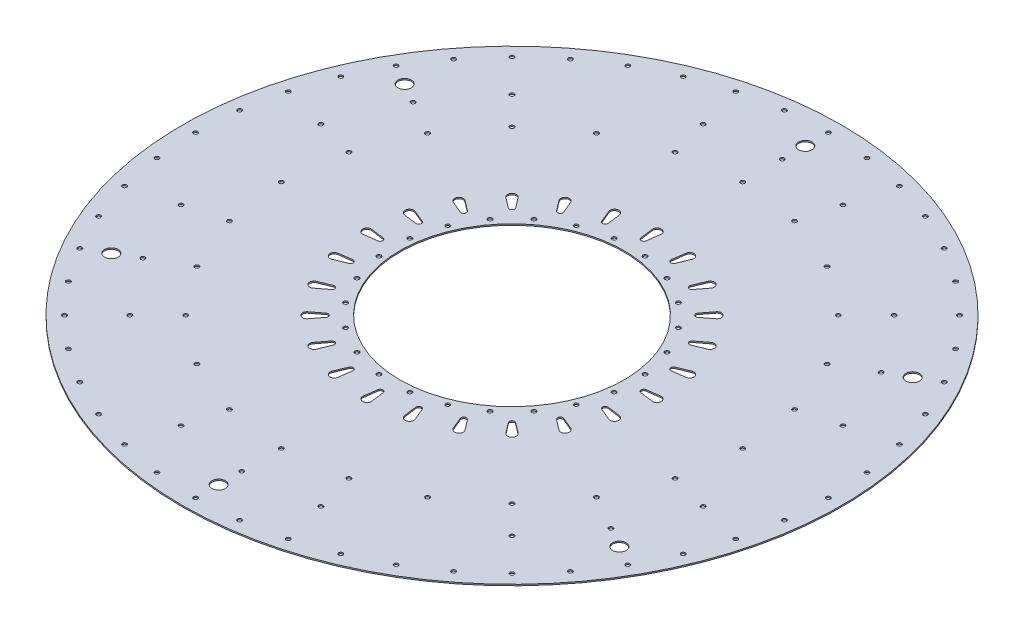
from build123d import *

# Parameters (mm, degrees)
SKETCH2_R           = 250
SKETCH2_R_2         = 1.6
SKETCH2_R_3         = 85
SKETCH2_R_4         = 5.1
BOSS_EXTRUDE1_DEPTH = 0.5


with BuildPart() as part:
    # Sketch2 → Boss-Extrude1 (new, symmetric)
    with BuildSketch(Plane(origin=(0, 0, 0), x_dir=(1, 0, 0), z_dir=(0, 1, 0))):
        with Locations(Location((0, 0, 0), (0, 0, 270))):
            Circle(SKETCH2_R)
        with Locations(Location((0, 240, 0), (0, 0, 270))):
            Circle(SKETCH2_R_2, mode=Mode.SUBTRACT)
        with Locations(Location((0, 0, 0), (0, 0, 270))):
            Circle(SKETCH2_R_3, mode=Mode.SUBTRACT)
        with Locations(Location((31.326286133, 237.94676673, 0), (0, 0, 270))):
            Circle(SKETCH2_R_2, mode=Mode.SUBTRACT)
        with Locations(Location((62.116570825, 231.822198309, 0), (0, 0, 270))):
            Circle(SKETCH2_R_2, mode=Mode.SUBTRACT)
        with Locations(Location((91.844023768, 221.731087803, 0), (0, 0, 270))):
            Circle(SKETCH2_R_2, mode=Mode.SUBTRACT)
        with Locations(Location((120, 207.846096908, 0), (0, 0, 270))):
            Circle(SKETCH2_R_2, mode=Mode.SUBTRACT)
        with Locations(Location((146.102742962, 190.40480167, 0), (0, 0, 270))):
            Circle(SKETCH2_R_2, mode=Mode.SUBTRACT)
        with Locations(Location((207.846096908, -120, 0), (0, 0, 270))):
            Circle(SKETCH2_R_2, mode=Mode.SUBTRACT)
        with Locations(Location((169.705627485, -169.705627485, 0), (0, 0, 270))):
            Circle(SKETCH2_R_2, mode=Mode.SUBTRACT)
        with Locations(Location((120, -207.846096908, 0), (0, 0, 270))):
            Circle(SKETCH2_R_2, mode=Mode.SUBTRACT)
        with Locations(Location((62.116570825, -231.822198309, 0), (0, 0, 270))):
            Circle(SKETCH2_R_2, mode=Mode.SUBTRACT)
        with Locations(Location((0, -240, 0), (0, 0, 270))):
            Circle(SKETCH2_R_2, mode=Mode.SUBTRACT)
        with Locations(Location((-62.116570825, -231.822198309, 0), (0, 0, 270))):
            Circle(SKETCH2_R_2, mode=Mode.SUBTRACT)
        with Locations(Location((-120, -207.846096908, 0), (0, 0, 270))):
            Circle(SKETCH2_R_2, mode=Mode.SUBTRACT)
        with Locations(Location((-169.705627485, -169.705627485, 0), (0, 0, 270))):
            Circle(SKETCH2_R_2, mode=Mode.SUBTRACT)
        with Locations(Location((-207.846096908, -120, 0), (0, 0, 270))):
            Circle(SKETCH2_R_2, mode=Mode.SUBTRACT)
        with Locations(Location((-231.822198309, -62.116570825, 0), (0, 0, 270))):
            Circle(SKETCH2_R_2, mode=Mode.SUBTRACT)
        with Locations(Location((-240, 0, 0), (0, 0, 270))):
            Circle(SKETCH2_R_2, mode=Mode.SUBTRACT)
        with Locations(Location((-231.822198309, 62.116570825, 0), (0, 0, 270))):
            Circle(SKETCH2_R_2, mode=Mode.SUBTRACT)
        with Locations(Location((-207.846096908, 120, 0), (0, 0, 270))):
            Circle(SKETCH2_R_2, mode=Mode.SUBTRACT)
        with Locations(Location((-169.705627485, 169.705627485, 0), (0, 0, 270))):
            Circle(SKETCH2_R_2, mode=Mode.SUBTRACT)
        with Locations(Location((-120, 207.846096908, 0), (0, 0, 270))):
            Circle(SKETCH2_R_2, mode=Mode.SUBTRACT)
        with Locations(Location((-62.116570825, 231.822198309, 0), (0, 0, 270))):
            Circle(SKETCH2_R_2, mode=Mode.SUBTRACT)
        with Locations(Location((169.705627485, 169.705627485, 0), (0, 0, 270))):
            Circle(SKETCH2_R_2, mode=Mode.SUBTRACT)
        with Locations(Location((190.40480167, 146.102742962, 0), (0, 0, 270))):
            Circle(SKETCH2_R_2, mode=Mode.SUBTRACT)
        with Locations(Location((207.846096908, 120, 0), (0, 0, 270))):
            Circle(SKETCH2_R_2, mode=Mode.SUBTRACT)
        with Locations(Location((221.731087803, 91.844023768, 0), (0, 0, 270))):
            Circle(SKETCH2_R_2, mode=Mode.SUBTRACT)
        with Locations(Location((231.822198309, 62.116570825, 0), (0, 0, 270))):
            Circle(SKETCH2_R_2, mode=Mode.SUBTRACT)
        with Locations(Location((237.94676673, 31.326286133, 0), (0, 0, 270))):
            Circle(SKETCH2_R_2, mode=Mode.SUBTRACT)
        with Locations(Location((240, 0, 0), (0, 0, 270))):
            Circle(SKETCH2_R_2, mode=Mode.SUBTRACT)
        with Locations(Location((237.94676673, -31.326286133, 0), (0, 0, 270))):
            Circle(SKETCH2_R_2, mode=Mode.SUBTRACT)
        with Locations(Location((231.822198309, -62.116570825, 0), (0, 0, 270))):
            Circle(SKETCH2_R_2, mode=Mode.SUBTRACT)
        with Locations(Location((221.731087803, -91.844023768, 0), (0, 0, 270))):
            Circle(SKETCH2_R_2, mode=Mode.SUBTRACT)
        with Locations(Location((190.40480167, -146.102742962, 0), (0, 0, 270))):
            Circle(SKETCH2_R_2, mode=Mode.SUBTRACT)
        with Locations(Location((146.102742962, -190.40480167, 0), (0, 0, 270))):
            Circle(SKETCH2_R_2, mode=Mode.SUBTRACT)
        with Locations(Location((91.844023768, -221.731087803, 0), (0, 0, 270))):
            Circle(SKETCH2_R_2, mode=Mode.SUBTRACT)
        with Locations(Location((31.326286133, -237.94676673, 0), (0, 0, 270))):
            Circle(SKETCH2_R_2, mode=Mode.SUBTRACT)
        with Locations(Location((-31.326286133, -237.94676673, 0), (0, 0, 270))):
            Circle(SKETCH2_R_2, mode=Mode.SUBTRACT)
        with Locations(Location((-91.844023768, -221.731087803, 0), (0, 0, 270))):
            Circle(SKETCH2_R_2, mode=Mode.SUBTRACT)
        with Locations(Location((-146.102742962, -190.40480167, 0), (0, 0, 270))):
            Circle(SKETCH2_R_2, mode=Mode.SUBTRACT)
        with Locations(Location((-190.40480167, -146.102742962, 0), (0, 0, 270))):
            Circle(SKETCH2_R_2, mode=Mode.SUBTRACT)
        with Locations(Location((-221.731087803, -91.844023768, 0), (0, 0, 270))):
            Circle(SKETCH2_R_2, mode=Mode.SUBTRACT)
        with Locations(Location((-237.94676673, -31.326286133, 0), (0, 0, 270))):
            Circle(SKETCH2_R_2, mode=Mode.SUBTRACT)
        with Locations(Location((-237.94676673, 31.326286133, 0), (0, 0, 270))):
            Circle(SKETCH2_R_2, mode=Mode.SUBTRACT)
        with Locations(Location((-221.731087803, 91.844023768, 0), (0, 0, 270))):
            Circle(SKETCH2_R_2, mode=Mode.SUBTRACT)
        with Locations(Location((-190.40480167, 146.102742962, 0), (0, 0, 270))):
            Circle(SKETCH2_R_2, mode=Mode.SUBTRACT)
        with Locations(Location((-146.102742962, 190.40480167, 0), (0, 0, 270))):
            Circle(SKETCH2_R_2, mode=Mode.SUBTRACT)
        with Locations(Location((-91.844023768, 221.731087803, 0), (0, 0, 270))):
            Circle(SKETCH2_R_2, mode=Mode.SUBTRACT)
        with Locations(Location((-31.326286133, 237.94676673, 0), (0, 0, 270))):
            Circle(SKETCH2_R_2, mode=Mode.SUBTRACT)
        with Locations(Location((0, 222.5, 0), (0, 0, 270))):
            Circle(SKETCH2_R_4, mode=Mode.SUBTRACT)
        with Locations(Location((192.690652342, 111.25, 0), (0, 0, 270))):
            Circle(SKETCH2_R_4, mode=Mode.SUBTRACT)
        with Locations(Location((192.690652342, -111.25, 0), (0, 0, 270))):
            Circle(SKETCH2_R_4, mode=Mode.SUBTRACT)
        with Locations(Location((0, -222.5, 0), (0, 0, 270))):
            Circle(SKETCH2_R_4, mode=Mode.SUBTRACT)
        with Locations(Location((-192.690652342, -111.25, 0), (0, 0, 270))):
            Circle(SKETCH2_R_4, mode=Mode.SUBTRACT)
        with Locations(Location((-192.690652342, 111.25, 0), (0, 0, 270))):
            Circle(SKETCH2_R_4, mode=Mode.SUBTRACT)
        with Locations(Location((0, 175, 0), (0, 0, 270))):
            Circle(SKETCH2_R_2, mode=Mode.SUBTRACT)
        with Locations(Location((45.293332893, 169.037019601, 0), (0, 0, 270))):
            Circle(SKETCH2_R_2, mode=Mode.SUBTRACT)
        with Locations(Location((87.5, 151.554445662, 0), (0, 0, 270))):
            Circle(SKETCH2_R_2, mode=Mode.SUBTRACT)
        with Locations(Location((123.743686708, 123.743686708, 0), (0, 0, 270))):
            Circle(SKETCH2_R_2, mode=Mode.SUBTRACT)
        with Locations(Location((151.554445662, 87.5, 0), (0, 0, 270))):
            Circle(SKETCH2_R_2, mode=Mode.SUBTRACT)
        with Locations(Location((169.037019601, 45.293332893, 0), (0, 0, 270))):
            Circle(SKETCH2_R_2, mode=Mode.SUBTRACT)
        with Locations(Location((175, 0, 0), (0, 0, 270))):
            Circle(SKETCH2_R_2, mode=Mode.SUBTRACT)
        with Locations(Location((169.037019601, -45.293332893, 0), (0, 0, 270))):
            Circle(SKETCH2_R_2, mode=Mode.SUBTRACT)
        with Locations(Location((151.554445662, -87.5, 0), (0, 0, 270))):
            Circle(SKETCH2_R_2, mode=Mode.SUBTRACT)
        with Locations(Location((123.743686708, -123.743686708, 0), (0, 0, 270))):
            Circle(SKETCH2_R_2, mode=Mode.SUBTRACT)
        with Locations(Location((87.5, -151.554445662, 0), (0, 0, 270))):
            Circle(SKETCH2_R_2, mode=Mode.SUBTRACT)
        with Locations(Location((45.293332893, -169.037019601, 0), (0, 0, 270))):
            Circle(SKETCH2_R_2, mode=Mode.SUBTRACT)
        with Locations(Location((0, -175, 0), (0, 0, 270))):
            Circle(SKETCH2_R_2, mode=Mode.SUBTRACT)
        with Locations(Location((-45.293332893, -169.037019601, 0), (0, 0, 270))):
            Circle(SKETCH2_R_2, mode=Mode.SUBTRACT)
        with Locations(Location((-87.5, -151.554445662, 0), (0, 0, 270))):
            Circle(SKETCH2_R_2, mode=Mode.SUBTRACT)
        with Locations(Location((-123.743686708, -123.743686708, 0), (0, 0, 270))):
            Circle(SKETCH2_R_2, mode=Mode.SUBTRACT)
        with Locations(Location((-151.554445662, -87.5, 0), (0, 0, 270))):
            Circle(SKETCH2_R_2, mode=Mode.SUBTRACT)
        with Locations(Location((-169.037019601, -45.293332893, 0), (0, 0, 270))):
            Circle(SKETCH2_R_2, mode=Mode.SUBTRACT)
        with Locations(Location((-175, 0, 0), (0, 0, 270))):
            Circle(SKETCH2_R_2, mode=Mode.SUBTRACT)
        with Locations(Location((-169.037019601, 45.293332893, 0), (0, 0, 270))):
            Circle(SKETCH2_R_2, mode=Mode.SUBTRACT)
        with Locations(Location((-151.554445662, 87.5, 0), (0, 0, 270))):
            Circle(SKETCH2_R_2, mode=Mode.SUBTRACT)
        with Locations(Location((-123.743686708, 123.743686708, 0), (0, 0, 270))):
            Circle(SKETCH2_R_2, mode=Mode.SUBTRACT)
        with Locations(Location((-87.5, 151.554445662, 0), (0, 0, 270))):
            Circle(SKETCH2_R_2, mode=Mode.SUBTRACT)
        with Locations(Location((-45.293332893, 169.037019601, 0), (0, 0, 270))):
            Circle(SKETCH2_R_2, mode=Mode.SUBTRACT)
        with Locations(Location((-198.014794389, 53.057904246, 0), (0, 0, 270))):
            Circle(SKETCH2_R_2, mode=Mode.SUBTRACT)
        with Locations(Location((-177.535207776, 102.5, 0), (0, 0, 270))):
            Circle(SKETCH2_R_2, mode=Mode.SUBTRACT)
        with Locations(Location((-144.956890143, 144.956890143, 0), (0, 0, 270))):
            Circle(SKETCH2_R_2, mode=Mode.SUBTRACT)
        with Locations(Location((-53.057904246, 198.014794389, 0), (0, 0, 270))):
            Circle(SKETCH2_R_2, mode=Mode.SUBTRACT)
        with Locations(Location((0, 205, 0), (0, 0, 270))):
            Circle(SKETCH2_R_2, mode=Mode.SUBTRACT)
        with Locations(Location((53.057904246, 198.014794389, 0), (0, 0, 270))):
            Circle(SKETCH2_R_2, mode=Mode.SUBTRACT)
        with Locations(Location((144.956890143, 144.956890143, 0), (0, 0, 270))):
            Circle(SKETCH2_R_2, mode=Mode.SUBTRACT)
        with Locations(Location((177.535207776, 102.5, 0), (0, 0, 270))):
            Circle(SKETCH2_R_2, mode=Mode.SUBTRACT)
        with Locations(Location((198.014794389, 53.057904246, 0), (0, 0, 270))):
            Circle(SKETCH2_R_2, mode=Mode.SUBTRACT)
        with Locations(Location((198.014794389, -53.057904246, 0), (0, 0, 270))):
            Circle(SKETCH2_R_2, mode=Mode.SUBTRACT)
        with Locations(Location((177.535207776, -102.5, 0), (0, 0, 270))):
            Circle(SKETCH2_R_2, mode=Mode.SUBTRACT)
        with Locations(Location((144.956890143, -144.956890143, 0), (0, 0, 270))):
            Circle(SKETCH2_R_2, mode=Mode.SUBTRACT)
        with Locations(Location((53.057904246, -198.014794389, 0), (0, 0, 270))):
            Circle(SKETCH2_R_2, mode=Mode.SUBTRACT)
        with Locations(Location((0, -205, 0), (0, 0, 270))):
            Circle(SKETCH2_R_2, mode=Mode.SUBTRACT)
        with Locations(Location((-53.057904246, -198.014794389, 0), (0, 0, 270))):
            Circle(SKETCH2_R_2, mode=Mode.SUBTRACT)
        with Locations(Location((-144.956890143, -144.956890143, 0), (0, 0, 270))):
            Circle(SKETCH2_R_2, mode=Mode.SUBTRACT)
        with Locations(Location((-177.535207776, -102.5, 0), (0, 0, 270))):
            Circle(SKETCH2_R_2, mode=Mode.SUBTRACT)
        with Locations(Location((-198.014794389, -53.057904246, 0), (0, 0, 270))):
            Circle(SKETCH2_R_2, mode=Mode.SUBTRACT)
        with Locations(Location((-11.7473573, 89.230037524, 0), (0, 0, 270))):
            Circle(SKETCH2_R_2, mode=Mode.SUBTRACT)
        with Locations(Location((11.7473573, 89.230037524, 0), (0, 0, 270))):
            Circle(SKETCH2_R_2, mode=Mode.SUBTRACT)
        with Locations(Location((34.441508913, 83.149157926, 0), (0, 0, 270))):
            Circle(SKETCH2_R_2, mode=Mode.SUBTRACT)
        with Locations(Location((54.788528611, 71.401800626, 0), (0, 0, 270))):
            Circle(SKETCH2_R_2, mode=Mode.SUBTRACT)
        with Locations(Location((71.401800626, 54.788528611, 0), (0, 0, 270))):
            Circle(SKETCH2_R_2, mode=Mode.SUBTRACT)
        with Locations(Location((83.149157926, 34.441508913, 0), (0, 0, 270))):
            Circle(SKETCH2_R_2, mode=Mode.SUBTRACT)
        with Locations(Location((89.230037524, 11.7473573, 0), (0, 0, 270))):
            Circle(SKETCH2_R_2, mode=Mode.SUBTRACT)
        with Locations(Location((89.230037524, -11.7473573, 0), (0, 0, 270))):
            Circle(SKETCH2_R_2, mode=Mode.SUBTRACT)
        with Locations(Location((83.149157926, -34.441508913, 0), (0, 0, 270))):
            Circle(SKETCH2_R_2, mode=Mode.SUBTRACT)
        with Locations(Location((71.401800626, -54.788528611, 0), (0, 0, 270))):
            Circle(SKETCH2_R_2, mode=Mode.SUBTRACT)
        with Locations(Location((54.788528611, -71.401800626, 0), (0, 0, 270))):
            Circle(SKETCH2_R_2, mode=Mode.SUBTRACT)
        with Locations(Location((34.441508913, -83.149157926, 0), (0, 0, 270))):
            Circle(SKETCH2_R_2, mode=Mode.SUBTRACT)
        with Locations(Location((11.7473573, -89.230037524, 0), (0, 0, 270))):
            Circle(SKETCH2_R_2, mode=Mode.SUBTRACT)
        with Locations(Location((-11.7473573, -89.230037524, 0), (0, 0, 270))):
            Circle(SKETCH2_R_2, mode=Mode.SUBTRACT)
        with Locations(Location((-34.441508913, -83.149157926, 0), (0, 0, 270))):
            Circle(SKETCH2_R_2, mode=Mode.SUBTRACT)
        with Locations(Location((-54.788528611, -71.401800626, 0), (0, 0, 270))):
            Circle(SKETCH2_R_2, mode=Mode.SUBTRACT)
        with Locations(Location((-71.401800626, -54.788528611, 0), (0, 0, 270))):
            Circle(SKETCH2_R_2, mode=Mode.SUBTRACT)
        with Locations(Location((-83.149157926, -34.441508913, 0), (0, 0, 270))):
            Circle(SKETCH2_R_2, mode=Mode.SUBTRACT)
        with Locations(Location((-89.230037524, -11.7473573, 0), (0, 0, 270))):
            Circle(SKETCH2_R_2, mode=Mode.SUBTRACT)
        with Locations(Location((-89.230037524, 11.7473573, 0), (0, 0, 270))):
            Circle(SKETCH2_R_2, mode=Mode.SUBTRACT)
        with Locations(Location((-83.149157926, 34.441508913, 0), (0, 0, 270))):
            Circle(SKETCH2_R_2, mode=Mode.SUBTRACT)
        with Locations(Location((-71.401800626, 54.788528611, 0), (0, 0, 270))):
            Circle(SKETCH2_R_2, mode=Mode.SUBTRACT)
        with Locations(Location((-54.788528611, 71.401800626, 0), (0, 0, 270))):
            Circle(SKETCH2_R_2, mode=Mode.SUBTRACT)
        with Locations(Location((-34.441508913, 83.149157926, 0), (0, 0, 270))):
            Circle(SKETCH2_R_2, mode=Mode.SUBTRACT)
        with BuildLine():
            Line((3.276984948, 109.568576747), (1.982889723, 99.738947616))
            ThreePointArc((1.982889723, 99.738947616), (0, 98), (-1.982889723, 99.738947616))
            Line((-1.982889723, 99.738947616), (-3.276984948, 109.568576747))
            ThreePointArc((-3.276984948, 109.568576747), (0, 113.305261922), (3.276984948, 109.568576747))
        make_face(mode=Mode.SUBTRACT)
        with BuildLine():
            Line((31.523758801, 104.986971915), (27.729663575, 95.827215764))
            ThreePointArc((27.729663575, 95.827215764), (25.36426642, 94.660730976), (23.899014788, 96.853635013))
            Line((23.899014788, 96.853635013), (25.193110013, 106.683264145))
            ThreePointArc((25.193110013, 106.683264145), (29.325559696, 109.444478745), (31.523758801, 104.986971915))
        make_face(mode=Mode.SUBTRACT)
        with BuildLine():
            Line((57.622240587, 93.250678445), (51.586706681, 85.38501752))
            ThreePointArc((51.586706681, 85.38501752), (49, 84.870489571), (48.152240935, 87.367907243))
            Line((48.152240935, 87.367907243), (51.94633616, 96.527663394))
            ThreePointArc((51.94633616, 96.527663394), (56.652630961, 98.125235207), (57.622240587, 93.250678445))
        make_face(mode=Mode.SUBTRACT)
        with BuildLine():
            Line((79.793861902, 75.159505344), (71.928200977, 69.123971438))
            ThreePointArc((71.928200977, 69.123971438), (69.296464556, 69.296464556), (69.123971438, 71.928200977))
            Line((69.123971438, 71.928200977), (75.159505344, 79.793861902))
            ThreePointArc((75.159505344, 79.793861902), (80.118919049, 80.118919049), (79.793861902, 75.159505344))
        make_face(mode=Mode.SUBTRACT)
        with BuildLine():
            Line((96.527663394, 51.94633616), (87.367907243, 48.152240935))
            ThreePointArc((87.367907243, 48.152240935), (84.870489571, 49), (85.38501752, 51.586706681))
            Line((85.38501752, 51.586706681), (93.250678445, 57.622240587))
            ThreePointArc((93.250678445, 57.622240587), (98.125235207, 56.652630961), (96.527663394, 51.94633616))
        make_face(mode=Mode.SUBTRACT)
        with BuildLine():
            Line((106.683264145, 25.193110013), (96.853635013, 23.899014788))
            ThreePointArc((96.853635013, 23.899014788), (94.660730976, 25.36426642), (95.827215764, 27.729663575))
            Line((95.827215764, 27.729663575), (104.986971915, 31.523758801))
            ThreePointArc((104.986971915, 31.523758801), (109.444478745, 29.325559696), (106.683264145, 25.193110013))
        make_face(mode=Mode.SUBTRACT)
        with BuildLine():
            Line((109.568576747, -3.276984948), (99.738947616, -1.982889723))
            ThreePointArc((99.738947616, -1.982889723), (98, 0), (99.738947616, 1.982889723))
            Line((99.738947616, 1.982889723), (109.568576747, 3.276984948))
            ThreePointArc((109.568576747, 3.276984948), (113.305261922, 0), (109.568576747, -3.276984948))
        make_face(mode=Mode.SUBTRACT)
        with BuildLine():
            Line((104.986971915, -31.523758801), (95.827215764, -27.729663575))
            ThreePointArc((95.827215764, -27.729663575), (94.660730976, -25.36426642), (96.853635013, -23.899014788))
            Line((96.853635013, -23.899014788), (106.683264145, -25.193110013))
            ThreePointArc((106.683264145, -25.193110013), (109.444478745, -29.325559696), (104.986971915, -31.523758801))
        make_face(mode=Mode.SUBTRACT)
        with BuildLine():
            Line((93.250678445, -57.622240587), (85.38501752, -51.586706681))
            ThreePointArc((85.38501752, -51.586706681), (84.870489571, -49), (87.367907243, -48.152240935))
            Line((87.367907243, -48.152240935), (96.527663394, -51.94633616))
            ThreePointArc((96.527663394, -51.94633616), (98.125235207, -56.652630961), (93.250678445, -57.622240587))
        make_face(mode=Mode.SUBTRACT)
        with BuildLine():
            Line((75.159505344, -79.793861902), (69.123971438, -71.928200977))
            ThreePointArc((69.123971438, -71.928200977), (69.296464556, -69.296464556), (71.928200977, -69.123971438))
            Line((71.928200977, -69.123971438), (79.793861902, -75.159505344))
            ThreePointArc((79.793861902, -75.159505344), (80.118919049, -80.118919049), (75.159505344, -79.793861902))
        make_face(mode=Mode.SUBTRACT)
        with BuildLine():
            Line((51.94633616, -96.527663394), (48.152240935, -87.367907243))
            ThreePointArc((48.152240935, -87.367907243), (49, -84.870489571), (51.586706681, -85.38501752))
            Line((51.586706681, -85.38501752), (57.622240587, -93.250678445))
            ThreePointArc((57.622240587, -93.250678445), (56.652630961, -98.125235207), (51.94633616, -96.527663394))
        make_face(mode=Mode.SUBTRACT)
        with BuildLine():
            Line((25.193110013, -106.683264145), (23.899014788, -96.853635013))
            ThreePointArc((23.899014788, -96.853635013), (25.36426642, -94.660730976), (27.729663575, -95.827215764))
            Line((27.729663575, -95.827215764), (31.523758801, -104.986971915))
            ThreePointArc((31.523758801, -104.986971915), (29.325559696, -109.444478745), (25.193110013, -106.683264145))
        make_face(mode=Mode.SUBTRACT)
        with BuildLine():
            Line((-3.276984948, -109.568576747), (-1.982889723, -99.738947616))
            ThreePointArc((-1.982889723, -99.738947616), (0, -98), (1.982889723, -99.738947616))
            Line((1.982889723, -99.738947616), (3.276984948, -109.568576747))
            ThreePointArc((3.276984948, -109.568576747), (0, -113.305261922), (-3.276984948, -109.568576747))
        make_face(mode=Mode.SUBTRACT)
        with BuildLine():
            Line((-31.523758801, -104.986971915), (-27.729663575, -95.827215764))
            ThreePointArc((-27.729663575, -95.827215764), (-25.36426642, -94.660730976), (-23.899014787, -96.853635013))
            Line((-23.899014787, -96.853635013), (-25.193110013, -106.683264145))
            ThreePointArc((-25.193110013, -106.683264145), (-29.325559696, -109.444478745), (-31.523758801, -104.986971915))
        make_face(mode=Mode.SUBTRACT)
        with BuildLine():
            Line((-57.622240587, -93.250678445), (-51.586706681, -85.38501752))
            ThreePointArc((-51.586706681, -85.38501752), (-49, -84.870489571), (-48.152240935, -87.367907243))
            Line((-48.152240935, -87.367907243), (-51.94633616, -96.527663394))
            ThreePointArc((-51.94633616, -96.527663394), (-56.652630961, -98.125235207), (-57.622240587, -93.250678445))
        make_face(mode=Mode.SUBTRACT)
        with BuildLine():
            Line((-79.793861902, -75.159505344), (-71.928200977, -69.123971438))
            ThreePointArc((-71.928200977, -69.123971438), (-69.296464556, -69.296464556), (-69.123971438, -71.928200977))
            Line((-69.123971438, -71.928200977), (-75.159505344, -79.793861902))
            ThreePointArc((-75.159505344, -79.793861902), (-80.118919049, -80.118919049), (-79.793861902, -75.159505344))
        make_face(mode=Mode.SUBTRACT)
        with BuildLine():
            Line((-96.527663394, -51.94633616), (-87.367907243, -48.152240935))
            ThreePointArc((-87.367907243, -48.152240935), (-84.870489571, -49), (-85.38501752, -51.586706681))
            Line((-85.38501752, -51.586706681), (-93.250678445, -57.622240587))
            ThreePointArc((-93.250678445, -57.622240587), (-98.125235207, -56.652630961), (-96.527663394, -51.94633616))
        make_face(mode=Mode.SUBTRACT)
        with BuildLine():
            Line((-106.683264145, -25.193110013), (-96.853635013, -23.899014788))
            ThreePointArc((-96.853635013, -23.899014788), (-94.660730976, -25.36426642), (-95.827215764, -27.729663575))
            Line((-95.827215764, -27.729663575), (-104.986971915, -31.523758801))
            ThreePointArc((-104.986971915, -31.523758801), (-109.444478745, -29.325559696), (-106.683264145, -25.193110013))
        make_face(mode=Mode.SUBTRACT)
        with BuildLine():
            Line((-109.568576747, 3.276984948), (-99.738947616, 1.982889723))
            ThreePointArc((-99.738947616, 1.982889723), (-98, 0), (-99.738947616, -1.982889723))
            Line((-99.738947616, -1.982889723), (-109.568576747, -3.276984948))
            ThreePointArc((-109.568576747, -3.276984948), (-113.305261922, 0), (-109.568576747, 3.276984948))
        make_face(mode=Mode.SUBTRACT)
        with BuildLine():
            Line((-104.986971915, 31.523758801), (-95.827215764, 27.729663575))
            ThreePointArc((-95.827215764, 27.729663575), (-94.660730976, 25.36426642), (-96.853635013, 23.899014788))
            Line((-96.853635013, 23.899014788), (-106.683264145, 25.193110013))
            ThreePointArc((-106.683264145, 25.193110013), (-109.444478745, 29.325559696), (-104.986971915, 31.523758801))
        make_face(mode=Mode.SUBTRACT)
        with BuildLine():
            Line((-93.250678445, 57.622240587), (-85.38501752, 51.586706681))
            ThreePointArc((-85.38501752, 51.586706681), (-84.870489571, 49), (-87.367907243, 48.152240935))
            Line((-87.367907243, 48.152240935), (-96.527663394, 51.94633616))
            ThreePointArc((-96.527663394, 51.94633616), (-98.125235207, 56.652630961), (-93.250678445, 57.622240587))
        make_face(mode=Mode.SUBTRACT)
        with BuildLine():
            Line((-75.159505344, 79.793861902), (-69.123971438, 71.928200977))
            ThreePointArc((-69.123971438, 71.928200977), (-69.296464556, 69.296464556), (-71.928200977, 69.123971438))
            Line((-71.928200977, 69.123971438), (-79.793861902, 75.159505344))
            ThreePointArc((-79.793861902, 75.159505344), (-80.118919049, 80.118919049), (-75.159505344, 79.793861902))
        make_face(mode=Mode.SUBTRACT)
        with BuildLine():
            Line((-51.94633616, 96.527663394), (-48.152240935, 87.367907243))
            ThreePointArc((-48.152240935, 87.367907243), (-49, 84.870489571), (-51.586706681, 85.38501752))
            Line((-51.586706681, 85.38501752), (-57.622240587, 93.250678445))
            ThreePointArc((-57.622240587, 93.250678445), (-56.652630961, 98.125235207), (-51.94633616, 96.527663394))
        make_face(mode=Mode.SUBTRACT)
        with BuildLine():
            Line((-25.193110013, 106.683264145), (-23.899014788, 96.853635013))
            ThreePointArc((-23.899014788, 96.853635013), (-25.36426642, 94.660730976), (-27.729663575, 95.827215764))
            Line((-27.729663575, 95.827215764), (-31.523758801, 104.986971915))
            ThreePointArc((-31.523758801, 104.986971915), (-29.325559696, 109.444478745), (-25.193110013, 106.683264145))
        make_face(mode=Mode.SUBTRACT)
    extrude(amount=BOSS_EXTRUDE1_DEPTH, both=True)


solid = part.part
